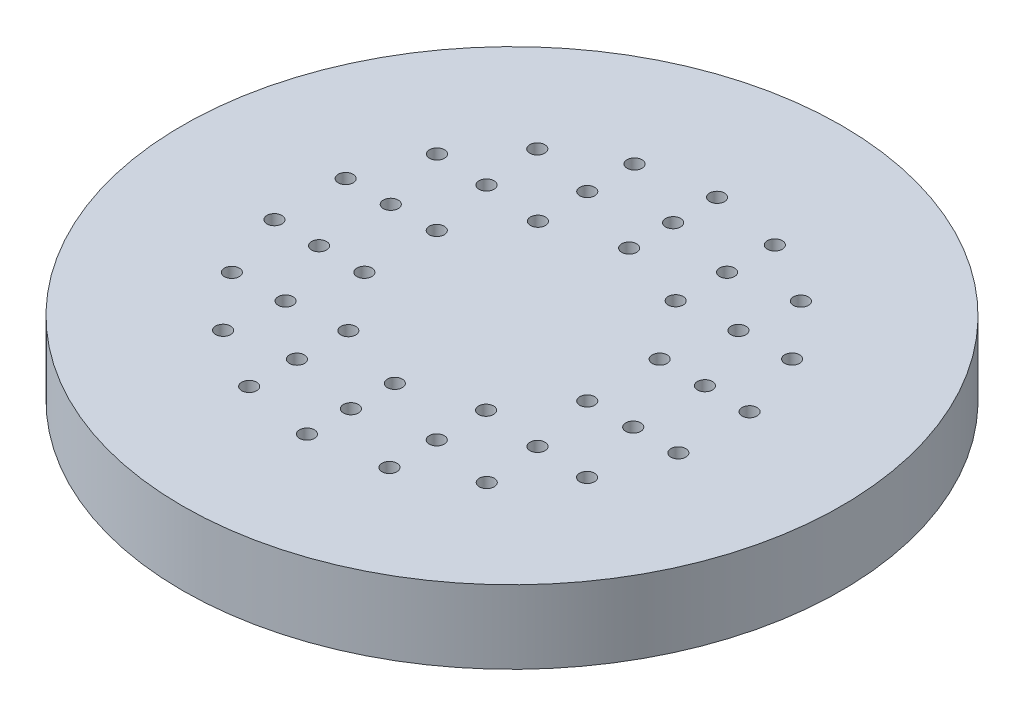
from build123d import *

# Parameters (mm, degrees)
MAIN_SHAPE_PROFILE_W    = 28.575
MAIN_SHAPE_PROFILE_H    = 6.35
DOWEL_HOLES_PROFILE_R   = 1.27
DOWEL_HOLES_DEPTH       = 2.54
F_3_8_16_TAPPED_HOLE1_D = 1.2954


with BuildPart() as part:
    # Main Shape Profile → Main Shape (revolve)
    with BuildSketch(Plane.XY, mode=Mode.PRIVATE) as main_shape_sk:
        with Locations((14.2875, 3.175)):
            Rectangle(MAIN_SHAPE_PROFILE_W, MAIN_SHAPE_PROFILE_H)
    revolve(main_shape_sk.sketch.rotate(Axis((0, 0, 0), (0, -1, 0)), 90), axis=Axis((0, 0, 0), (0, -1, 0)))

    # Dowel Holes Profile → Dowel Holes (cut)
    with BuildSketch(Plane.XZ):
        with Locations(Location((0, 25.4, 0), (0, 0, 270))):
            Circle(DOWEL_HOLES_PROFILE_R)
        with Locations(Location((0, -25.4, 0), (0, 0, 270))):
            Circle(DOWEL_HOLES_PROFILE_R)
    extrude(amount=-DOWEL_HOLES_DEPTH, mode=Mode.SUBTRACT)

    # 3/8-16 Tapped Hole1 (through all)
    with Locations(Plane(origin=(0, 6.35, 0), x_dir=(1, 0, 0), z_dir=(0, 1, 0))):
        with Locations((-5.971898163, -8.219612663), (0, -13.97), (0, -17.78), (-9.662734206, -3.139612663), (-9.662734206, 3.139612663), (-5.971898163, 8.219612663), (0, 10.16), (5.971898163, 8.219612663), (9.662734206, 3.139612663), (9.662734206, -3.139612663), (5.971898163, -8.219612663), (0, -10.16), (-6.061355835, -12.586535085), (-10.92218581, -8.710152532), (-13.619742933, -3.108617447), (-13.619742933, 3.108617447), (-10.92218581, 8.710152532), (-6.061355835, 12.586535085), (0, 13.97), (6.061355835, 12.586535085), (10.92218581, 8.710152532), (13.619742933, 3.108617447), (13.619742933, -3.108617447), (10.92218581, -8.710152532), (6.061355835, -12.586535085), (-6.081118148, -16.707734798), (-11.4287637, -13.620270199), (-15.397931679, -8.89), (-17.509881849, -3.087464599), (-17.509881849, 3.087464599), (-15.397931679, 8.89), (-11.4287637, 13.620270199), (-6.081118148, 16.707734798), (0, 17.78), (6.081118148, 16.707734798), (11.4287637, 13.620270199), (15.397931679, 8.89), (17.509881849, 3.087464599), (17.509881849, -3.087464599), (15.397931679, -8.89), (11.4287637, -13.620270199), (6.081118148, -16.707734798)):
            Hole(F_3_8_16_TAPPED_HOLE1_D / 2)


solid = part.part
